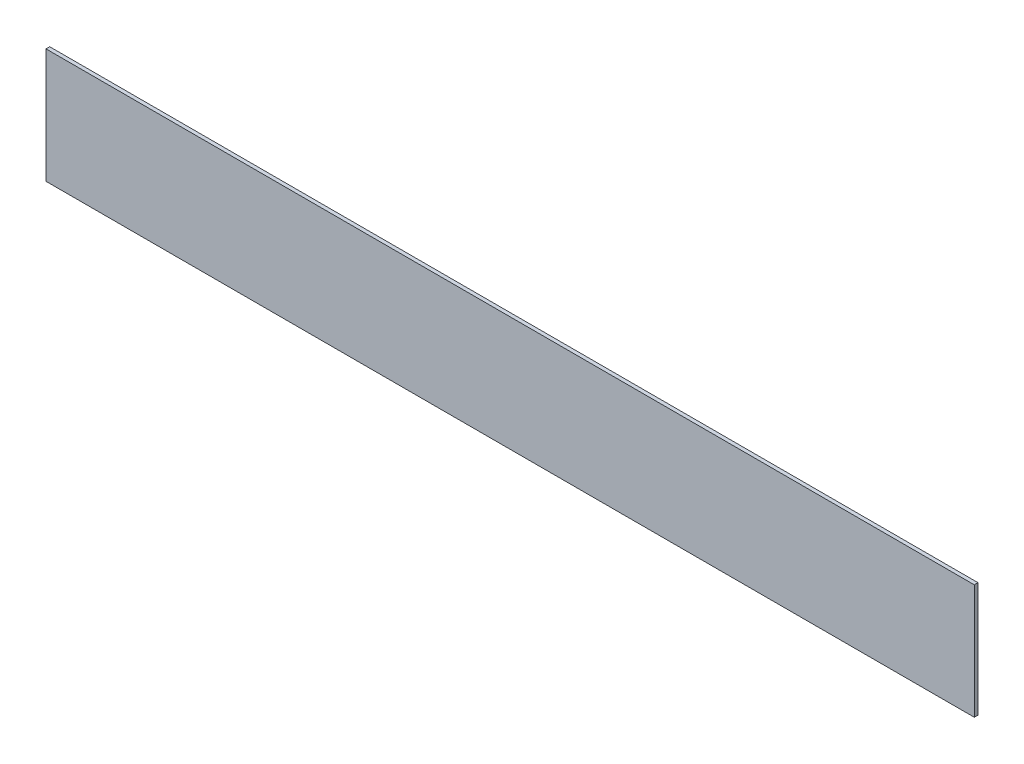
from build123d import *

# Parameters (mm, degrees)
SKETCH1_W           = 2500
SKETCH1_H           = 309
BOSS_EXTRUDE1_DEPTH = 10


with BuildPart() as part:
    # Sketch1 → Boss-Extrude1 (new body)
    with BuildSketch(Plane.XY):
        with Locations((1250, 154.5)):
            Rectangle(SKETCH1_W, SKETCH1_H)
    extrude(amount=BOSS_EXTRUDE1_DEPTH)


solid = part.part
